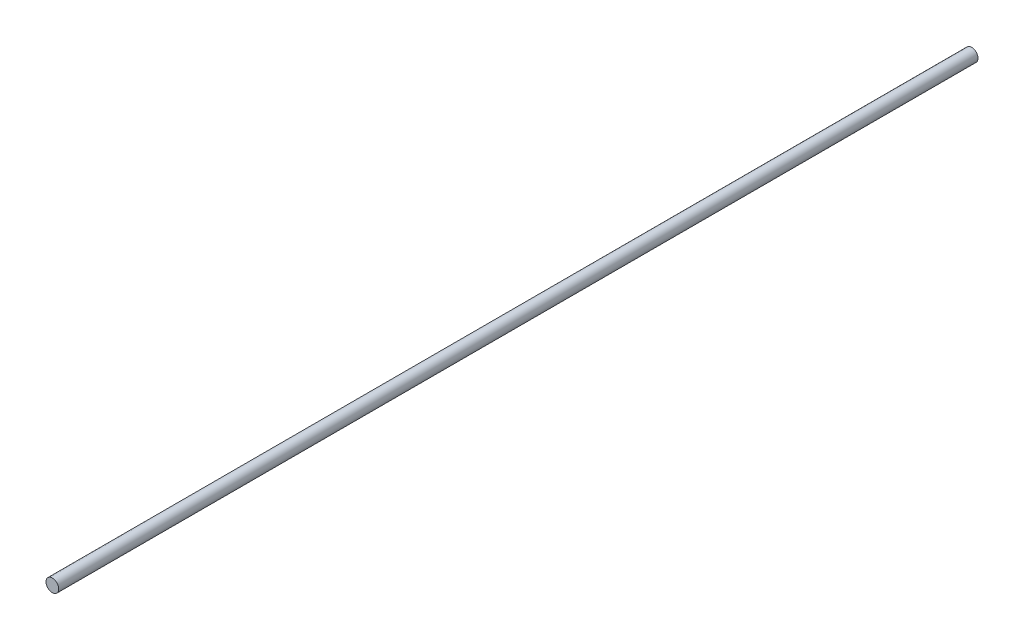
from build123d import *

# Parameters (mm, degrees)
ESQUISSE1_R        = 2.105
BOSS_EXTRU_1_DEPTH = 304.5


with BuildPart() as part:
    # Esquisse1 → Boss.-Extru.1 (new body)
    with BuildSketch(Plane.XY):
        Circle(ESQUISSE1_R)
    extrude(amount=BOSS_EXTRU_1_DEPTH)


solid = part.part
